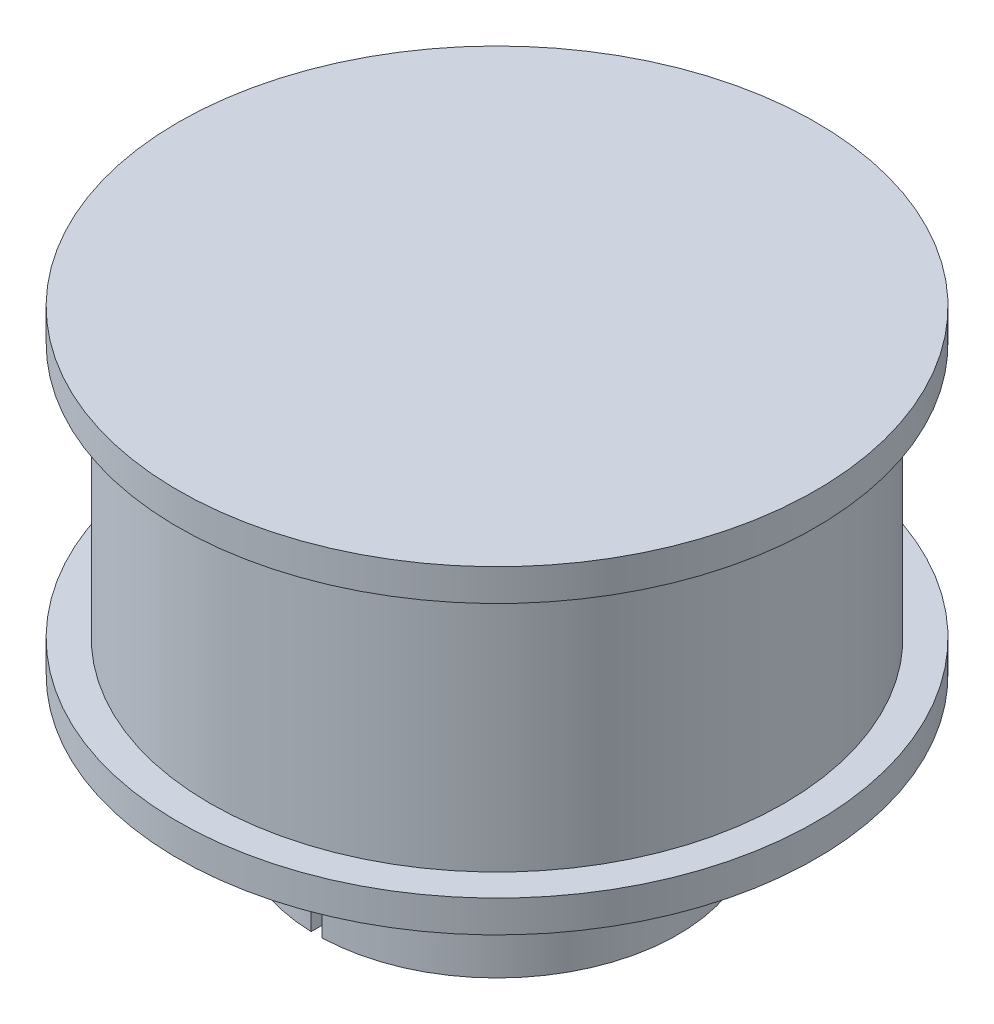
from build123d import *

# Parameters (mm, degrees)
CBORE_FOR_M2_SHCS1_D           = 2.4
CBORE_FOR_M2_SHCS1_CBORE_D     = 4.4
CBORE_FOR_M2_SHCS1_CBORE_DEPTH = 2
CUT_EXTRUDE1_REACH             = 27.981
SKETCH4_W                      = 0.5
SKETCH4_H                      = 8.5
SKETCH5_W                      = 18
SKETCH5_H                      = 0.5
CUT_EXTRUDE2_DEPTH             = 26.980762114


with BuildPart() as part:
    # Sketch1 → Revolve1 (revolve)
    with BuildSketch(Plane.XY):
        Polygon((-8.5, -6.35), (-8.5, 0), (-15, 0), (-15, 1.5), (-13.5, 1.5), (-13.5, 13.5), (-15, 13.5), (-15, 15), (0, 15), (0, 7.65), (-4, 7.65), (-4, -6.35), align=None)
    revolve(axis=Axis((0, 15, 0), (0, -1, 0)))

    # CBORE for M2 SHCS1 (through all)
    with Locations(Plane(origin=(-8.5, 0, 0), x_dir=(0, 0, -1), z_dir=(-1, 0, 0))):
        with Locations((-6.25, 3.175)):
            CounterBoreHole(CBORE_FOR_M2_SHCS1_D / 2, CBORE_FOR_M2_SHCS1_CBORE_D / 2, CBORE_FOR_M2_SHCS1_CBORE_DEPTH)

    # Sketch4 → Cut-Extrude1 (cut, up to next)
    with BuildSketch(Plane(origin=(0, 0, 0), x_dir=(1, 0, 0), z_dir=(0, 1, 0)), mode=Mode.PRIVATE) as cut_extrude1_sk1:
        with Locations((0, -4.25)):
            Rectangle(SKETCH4_W, SKETCH4_H)
    cut_extrude1_tool1 = extrude(cut_extrude1_sk1.sketch, amount=-CUT_EXTRUDE1_REACH, mode=Mode.PRIVATE) & part.part
    add(cut_extrude1_tool1.solids().sort_by_distance((0, 0, 4.25))[0], mode=Mode.SUBTRACT)

    # Sketch5 → Cut-Extrude2 (cut, through all)
    with BuildSketch(Plane.XY):
        with Locations((0, -0.25)):
            Rectangle(SKETCH5_W, SKETCH5_H)
    extrude(amount=CUT_EXTRUDE2_DEPTH, mode=Mode.SUBTRACT)


solid = part.part
